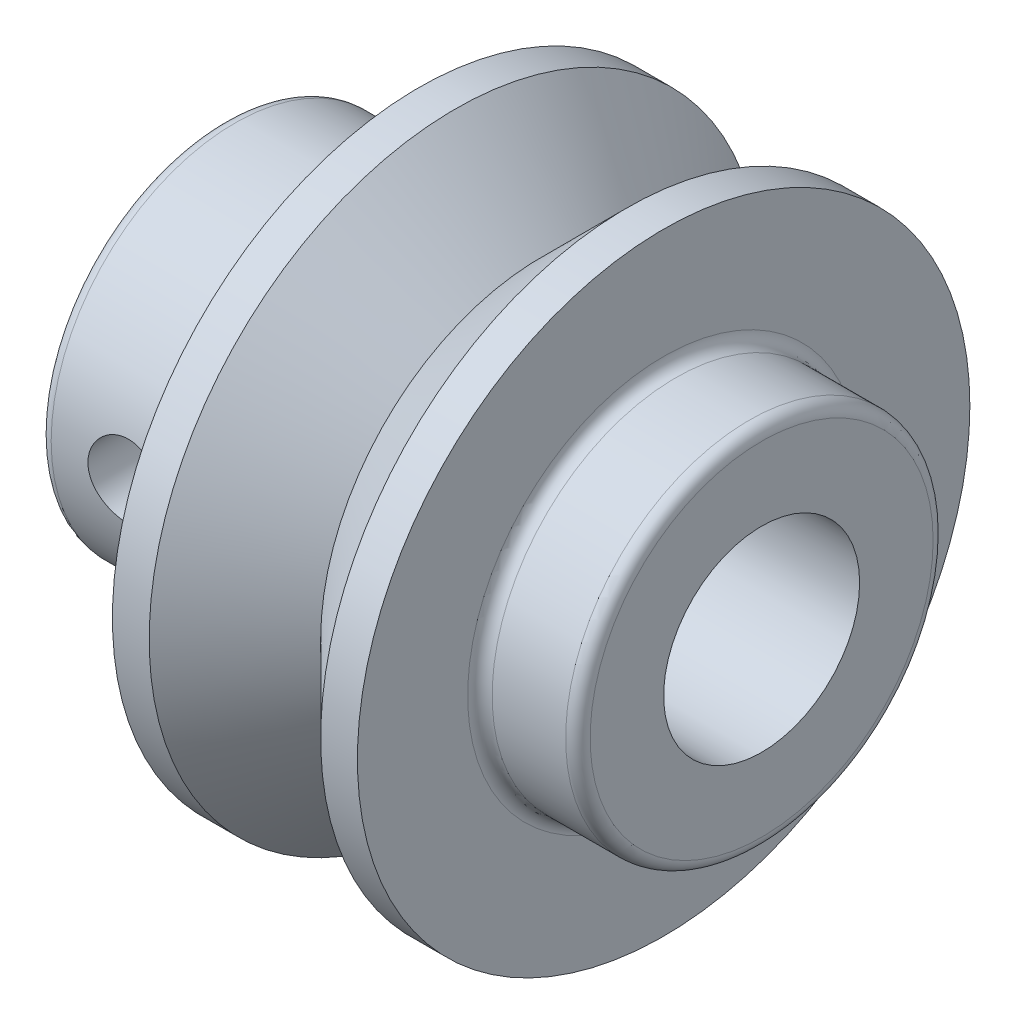
from build123d import *

# Parameters (mm, degrees)
SKETCH2_R          = 4
CUT_EXTRUDE1_DEPTH = 29.222331583
SKETCH3_R          = 1.5
CUT_EXTRUDE2_DEPTH = 20
FILLET1_R          = 0.5


with BuildPart() as part:
    # Sketch1 → Revolve1 (revolve)
    with BuildSketch(Plane.XY, mode=Mode.PRIVATE) as revolve1_sk:
        Polygon((0, 0), (0, 7.5), (8, 7.5), (8, 12.5), (9.5, 12.5), (13, 9), (16.5, 12.5), (18, 12.5), (18, 7.5), (22, 7.5), (22, 0), align=None)
    revolve(revolve1_sk.sketch.rotate(Axis((22, 0, 0), (-1, 0, 0)), 90), axis=Axis((22, 0, 0), (-1, 0, 0)))

    # Sketch2 → Cut-Extrude1 (cut, through all)
    with BuildSketch(Plane(origin=(22, 0, 0), x_dir=(0, 0, -1), z_dir=(1, 0, 0))):
        Circle(SKETCH2_R)
    extrude(amount=-CUT_EXTRUDE1_DEPTH, mode=Mode.SUBTRACT)

    # Sketch3 → Cut-Extrude2 (cut, symmetric)
    with BuildSketch(Plane.XY):
        with Locations((3.5, 0)):
            Circle(SKETCH3_R)
    extrude(amount=CUT_EXTRUDE2_DEPTH, both=True, mode=Mode.SUBTRACT)

    # Fillet1
    fillet1_edges = [part.edges().sort_by_distance(p)[0] for p in [
        (8, 0, 7.5),
        (0, 0, 7.5),
        (22, 0, 7.5),
        (18, 0, 7.5),
    ]]
    fillet(fillet1_edges, radius=FILLET1_R)


solid = part.part
